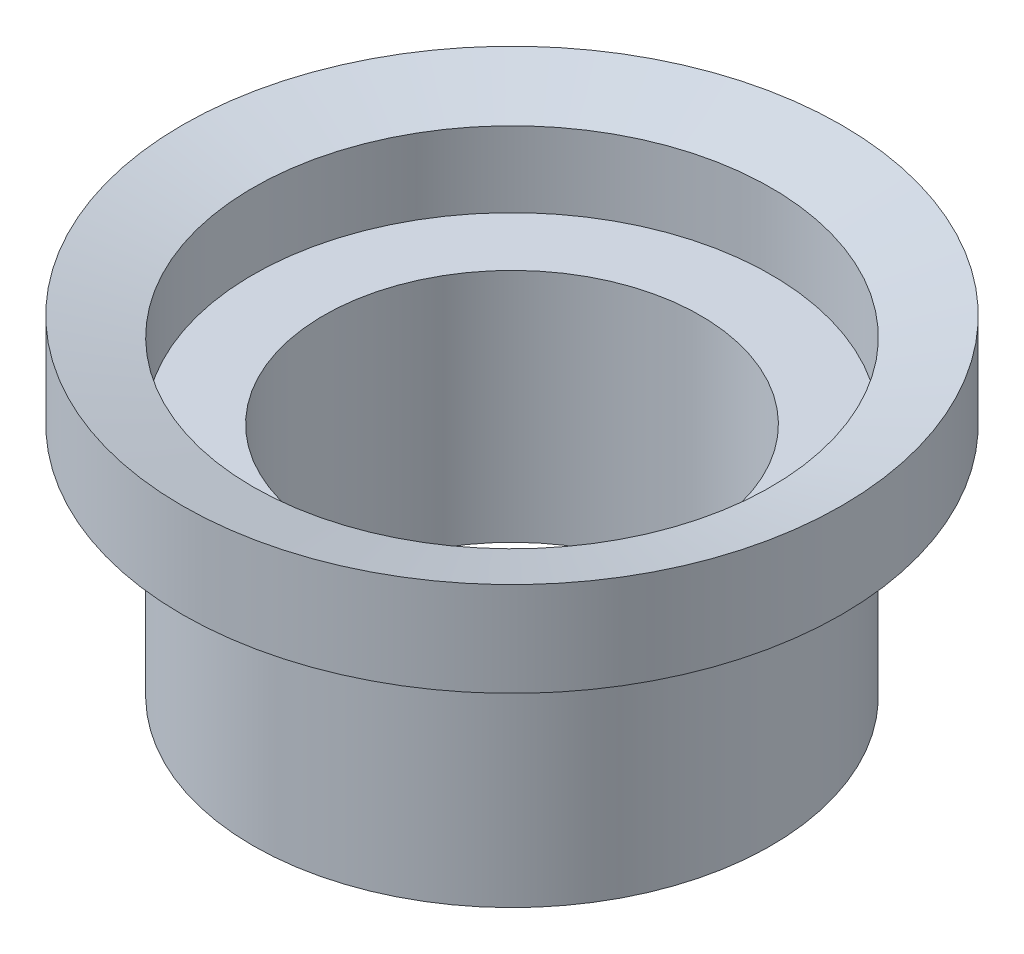
from build123d import *

# Parameters (mm, degrees)
SKETCH1_R           = 16.5
SKETCH1_R_2         = 12
BOSS_EXTRUDE1_DEPTH = 15
SKETCH2_R           = 21
SKETCH2_R_2         = 16.5
BOSS_EXTRUDE2_DEPTH = 6


with BuildPart() as part:
    # Sketch1 → Boss-Extrude1 (new body)
    with BuildSketch(Plane(origin=(0, 0, 0), x_dir=(1, 0, 0), z_dir=(0, 1, 0))):
        with Locations(Location((0, 0, 0), (0, 0, 270))):
            Circle(SKETCH1_R)
        with Locations(Location((0, 0, 0), (0, 0, 270))):
            Circle(SKETCH1_R_2, mode=Mode.SUBTRACT)
    extrude(amount=BOSS_EXTRUDE1_DEPTH)


with BuildPart() as body_2:
    # Sketch2 → Boss-Extrude2 (new body)
    with BuildSketch(Plane(origin=(0, 15, 0), x_dir=(1, 0, 0), z_dir=(0, 1, 0))):
        with Locations(Location((0, 0, 0), (0, 0, 270))):
            Circle(SKETCH2_R)
        with Locations(Location((0, 0, 0), (0, 0, 270))):
            Circle(SKETCH2_R_2, mode=Mode.SUBTRACT)
    extrude(amount=BOSS_EXTRUDE2_DEPTH)

    # Sketch3 → Cut-Revolve1 (revolve, cut)
    with BuildSketch(Plane.XY, mode=Mode.PRIVATE) as cut_revolve1_sk:
        Polygon((0, 21), (-21, 21), (0, 15.373066959), align=None)
    revolve(cut_revolve1_sk.sketch.rotate(Axis((0, 0, 0), (0, 1, 0)), 90), axis=Axis((0, 0, 0), (0, 1, 0)), mode=Mode.SUBTRACT)


solid = Compound([part.part, body_2.part])
